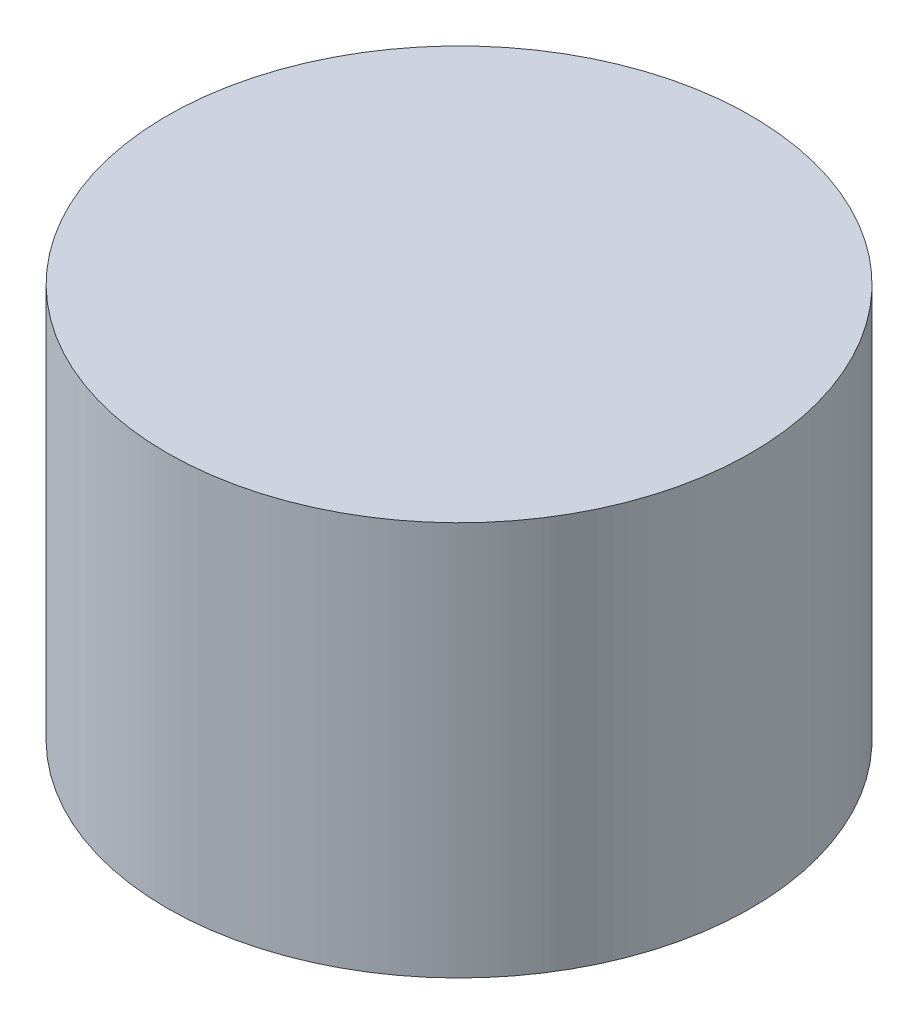
from build123d import *

# Parameters (mm, degrees)
SKETCH1_R           = 20
BOSS_EXTRUDE1_DEPTH = 27
SKETCH2_R           = 1.5
CUT_EXTRUDE1_DEPTH  = 6


with BuildPart() as part:
    # Sketch1 → Boss-Extrude1 (new body)
    with BuildSketch(Plane(origin=(0, 0, 0), x_dir=(1, 0, 0), z_dir=(0, 1, 0))):
        with Locations(Location((0, 0, 0), (0, 0, 270))):
            Circle(SKETCH1_R)
    extrude(amount=BOSS_EXTRUDE1_DEPTH)

    # Sketch2 → Cut-Extrude1 (cut)
    with BuildSketch(Plane.XZ):
        with Locations(Location((0, 13, 0), (0, 0, 270))):
            Circle(SKETCH2_R)
        with Locations(Location((11.258330249, -6.5, 0), (0, 0, 270))):
            Circle(SKETCH2_R)
        with Locations(Location((-11.258330249, -6.5, 0), (0, 0, 270))):
            Circle(SKETCH2_R)
    extrude(amount=-CUT_EXTRUDE1_DEPTH, mode=Mode.SUBTRACT)


solid = part.part
